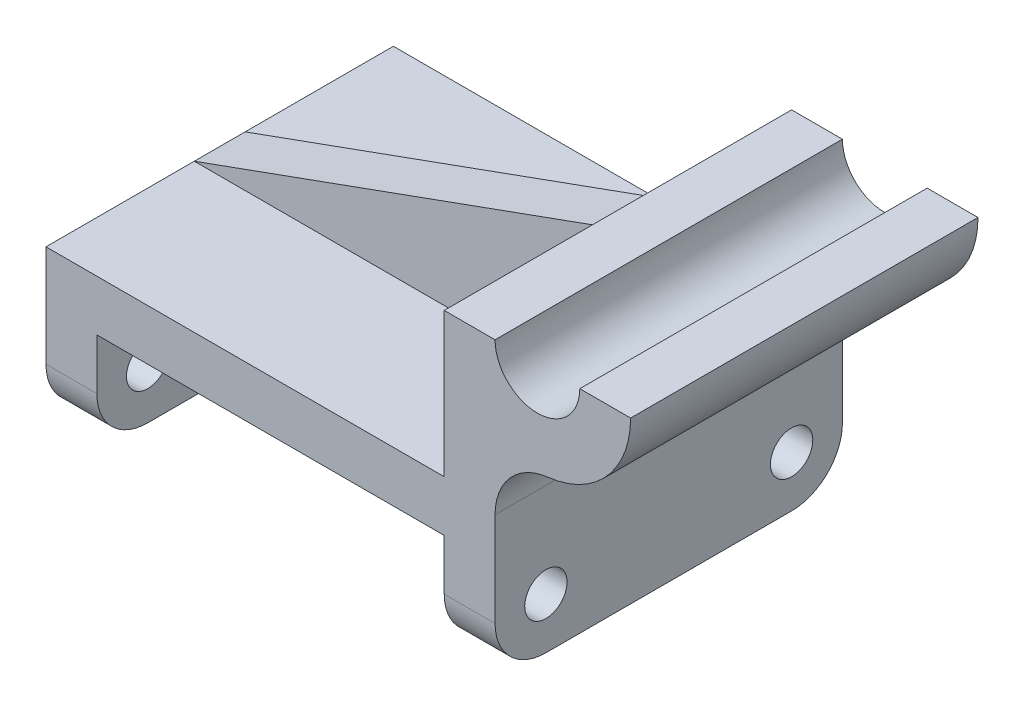
from build123d import *

# Parameters (mm, degrees)
BOSS_EXTRUDE4_DEPTH      = 2082.8
SKETCH3_W                = 2387.6
SKETCH3_H                = 304.8
BOSS_EXTRUDE5_DEPTH      = 863.6
CUT_EXTRUDE1_DEPTH       = 863.6
BOSS_EXTRUDE7_DEPTH      = 889
BOSS_EXTRUDE7_DEPTH_BACK = 1193.8
FILLET3_R                = 355.6
FILLET4_R                = 304.8
FILLET5_R                = 304.8
FILLET6_R                = 304.8
FILLET7_R                = 304.8
SKETCH9_R                = 127
CUT_EXTRUDE2_DEPTH       = 4242.419743435


with BuildPart() as part:
    # Sketch1 → Boss-Extrude4 (new body)
    with BuildSketch(Plane.XY):
        Polygon((-1346.2, -609.6), (-1346.2, 304.8), (1041.4, 304.8), (1041.4, 1168.4), (1346.2, 1168.4), (1346.2, -609.6), (1041.4, -609.6), (1041.4, 0), (-1041.4, 0), (-1041.4, -609.6), align=None)
    extrude(amount=BOSS_EXTRUDE4_DEPTH)

    # Sketch3 → Boss-Extrude5 (add)
    with BuildSketch(Plane(origin=(0, 304.8, 0), x_dir=(1, 0, 0), z_dir=(0, 1, 0))):
        with Locations((-152.4, -1041.4)):
            Rectangle(SKETCH3_W, SKETCH3_H)
    extrude(amount=BOSS_EXTRUDE5_DEPTH)

    # Sketch4 → Cut-Extrude1 (cut)
    with BuildSketch(Plane.XY.offset(1193.8)):
        Polygon((-1346.2, 304.8), (1041.4, 1168.4), (-1346.2, 1168.4), align=None)
    extrude(amount=-CUT_EXTRUDE1_DEPTH, mode=Mode.SUBTRACT)

    # Sketch6 → Boss-Extrude7 (add, two sides: drawn at the far end of the back side and taken through both)
    with BuildSketch(Plane.XY.offset(1193.8).offset(-BOSS_EXTRUDE7_DEPTH_BACK)):
        with BuildLine():
            Line((1041.4, 1168.4), (1346.2, 1168.4))
            ThreePointArc((1346.2, 1168.4), (1600.2, 914.4), (1854.2, 1168.4))
            Line((1854.2, 1168.4), (2159, 1168.4))
            ThreePointArc((2159, 1168.4), (1600.2, 609.6), (1041.4, 1168.4))
        make_face()
    extrude(amount=BOSS_EXTRUDE7_DEPTH + BOSS_EXTRUDE7_DEPTH_BACK)

    # Fillet3
    fillet3_edges = [part.edges().sort_by_distance(p)[0] for p in [
        (1346.2, 670.663684266, 1041.4),
    ]]
    fillet(fillet3_edges, radius=FILLET3_R)

    # Fillet4
    fillet4_edges = [part.edges().sort_by_distance(p)[0] for p in [
        (-1193.8, -609.6, 0),
    ]]
    fillet(fillet4_edges, radius=FILLET4_R)

    # Fillet5
    fillet5_edges = [part.edges().sort_by_distance(p)[0] for p in [
        (-1193.8, -609.6, 2082.8),
    ]]
    fillet(fillet5_edges, radius=FILLET5_R)

    # Fillet6
    fillet6_edges = [part.edges().sort_by_distance(p)[0] for p in [
        (1193.8, -609.6, 2082.8),
    ]]
    fillet(fillet6_edges, radius=FILLET6_R)

    # Fillet7
    fillet7_edges = [part.edges().sort_by_distance(p)[0] for p in [
        (1193.8, -609.6, 0),
    ]]
    fillet(fillet7_edges, radius=FILLET7_R)

    # Sketch9 → Cut-Extrude2 (cut, through all)
    with BuildSketch(Plane.ZY.offset(1346.2)):
        with Locations(Location((1778, -304.8, 0), (0, 0, 270))):
            Circle(SKETCH9_R)
        with Locations(Location((304.8, -304.8, 0), (0, 0, 270))):
            Circle(SKETCH9_R)
    extrude(amount=-CUT_EXTRUDE2_DEPTH, mode=Mode.SUBTRACT)


solid = part.part
